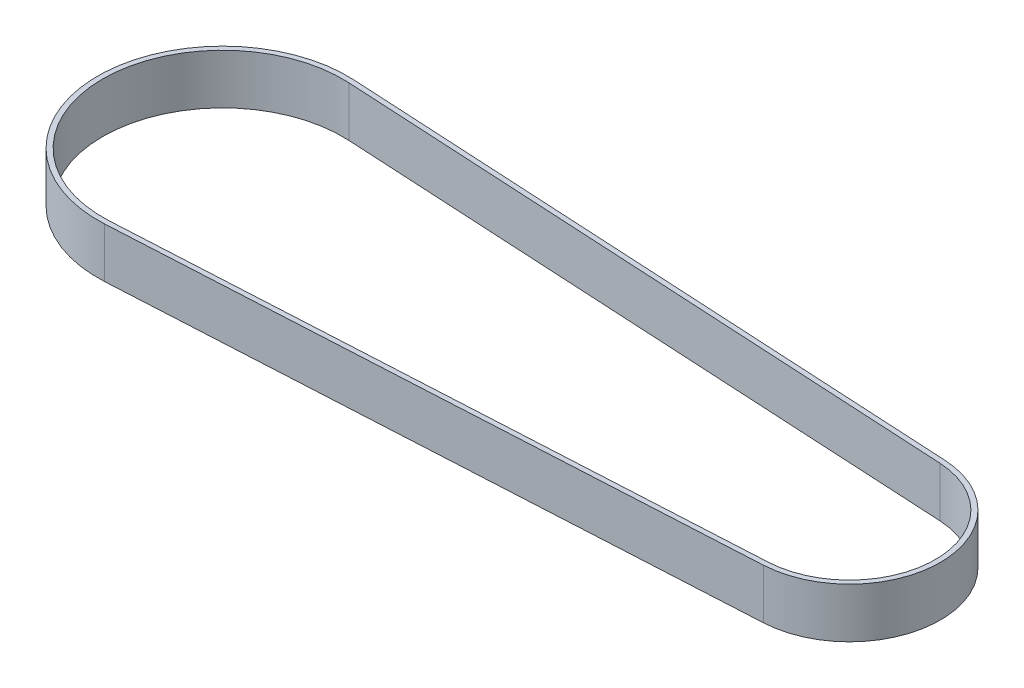
from build123d import *

# Parameters (mm, degrees)
BOSS_EXTRUDE1_DEPTH = 10


with BuildPart() as part:
    # Sketch1 → Boss-Extrude1 (new body)
    with BuildSketch(Plane(origin=(0, 0, 0), x_dir=(1, 0, 0), z_dir=(0, 1, 0))):
        with BuildLine():
            Line((1.354581673, 24.963275196), (126.486135458, 18.173264342))
            ThreePointArc((126.486135458, 18.173264342), (143.7, 0), (126.486135458, -18.173264342))
            Line((126.486135458, -18.173264342), (1.354581673, -24.963275196))
            ThreePointArc((1.354581673, -24.963275196), (-25, 0), (1.354581673, 24.963275196))
        make_face()
        with BuildLine():
            Line((1.300398406, 23.964744188), (126.431952191, 17.174733335))
            ThreePointArc((126.431952191, 17.174733335), (142.7, 0), (126.431952191, -17.174733335))
            Line((126.431952191, -17.174733335), (1.300398406, -23.964744188))
            ThreePointArc((1.300398406, -23.964744188), (-24, 0), (1.300398406, 23.964744188))
        make_face(mode=Mode.SUBTRACT)
    extrude(amount=BOSS_EXTRUDE1_DEPTH)


solid = part.part
